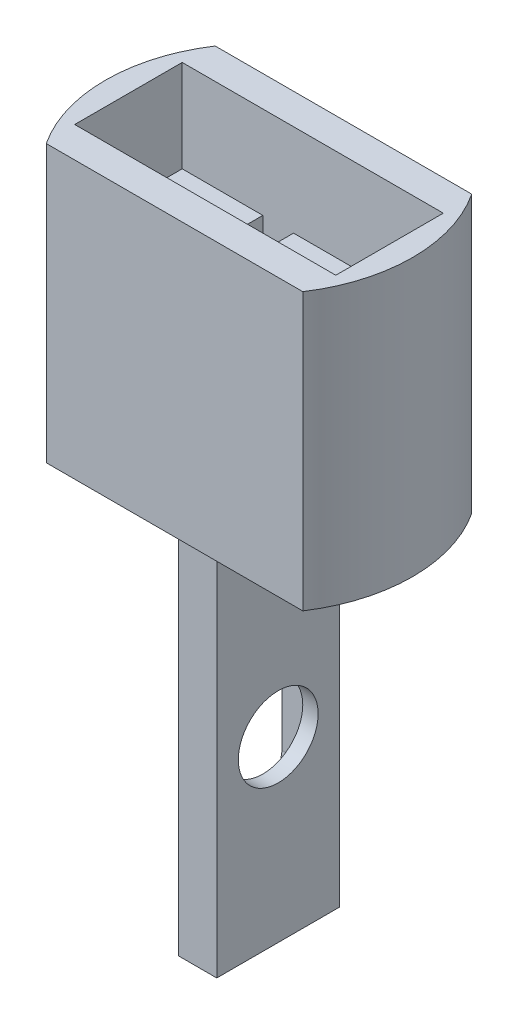
from build123d import *

# Parameters (mm, degrees)
SKETCH3_R           = 10
BOSS_EXTRUDE1_DEPTH = 18
SKETCH4_W           = 2.5
SKETCH4_H           = 8
BOSS_EXTRUDE2_DEPTH = 25
CUT_EXTRUDE1_REACH  = 31.182
SKETCH5_R           = 2.6
SKETCH7_W           = 17
SKETCH7_H           = 7
CUT_EXTRUDE3_DEPTH  = 6
SKETCH8_W           = 2
SKETCH8_H           = 7
CUT_EXTRUDE4_DEPTH  = 4
SKETCH11_W          = 5.5
SKETCH11_H          = 21
CUT_EXTRUDE7_DEPTH  = 1.5
CUT_EXTRUDE5_DEPTH  = 43
BOSS_EXTRUDE3_DEPTH = 1.5


with BuildPart() as part:
    # Sketch3 → Boss-Extrude1 (new body)
    with BuildSketch(Plane(origin=(0, 0, 0), x_dir=(1, 0, 0), z_dir=(0, 1, 0))):
        with Locations(Location((0, 0, 0), (0, 0, 270))):
            Circle(SKETCH3_R)
    extrude(amount=BOSS_EXTRUDE1_DEPTH)

    # Sketch4 → Boss-Extrude2 (add)
    with BuildSketch(Plane(origin=(0, 0, 0), x_dir=(-1, 0, 0), z_dir=(0, -1, 0))):
        Rectangle(SKETCH4_W, SKETCH4_H)
    extrude(amount=BOSS_EXTRUDE2_DEPTH)

    # Sketch5 → Cut-Extrude1 (cut, up to next)
    with BuildSketch(Plane(origin=(1.25, 0, 0), x_dir=(0, 0, -1), z_dir=(1, 0, 0)), mode=Mode.PRIVATE) as cut_extrude1_sk1:
        with Locations((0, -13.4)):
            Circle(SKETCH5_R)
    cut_extrude1_tool1 = extrude(cut_extrude1_sk1.sketch, amount=-CUT_EXTRUDE1_REACH, mode=Mode.PRIVATE) & part.part
    add(cut_extrude1_tool1.solids().sort_by_distance((1.25, -13.4, 0))[0], mode=Mode.SUBTRACT)

    # Sketch7 → Cut-Extrude3 (cut)
    with BuildSketch(Plane(origin=(0, 18, 0), x_dir=(1, 0, 0), z_dir=(0, 1, 0))):
        Rectangle(SKETCH7_W, SKETCH7_H)
    extrude(amount=-CUT_EXTRUDE3_DEPTH, mode=Mode.SUBTRACT)

    # Sketch8 → Cut-Extrude4 (cut)
    with BuildSketch(Plane(origin=(0, 12, 0), x_dir=(1, 0, 0), z_dir=(0, 1, 0))):
        with Locations((-2.25, 0)):
            Rectangle(SKETCH8_W, SKETCH8_H)
    extrude(amount=-CUT_EXTRUDE4_DEPTH, mode=Mode.SUBTRACT)

    # Sketch11 → Cut-Extrude7 (cut)
    with BuildSketch(Plane.ZY.offset(1.25)):
        with Locations((0, -13.4)):
            Rectangle(SKETCH11_W, SKETCH11_H)
    extrude(amount=-CUT_EXTRUDE7_DEPTH, mode=Mode.SUBTRACT)

    # Sketch9 → Cut-Extrude5 (cut)
    with BuildSketch(Plane.XZ):
        with BuildLine():
            Line((8.351646544, -5.5), (-8.351646544, -5.5))
            ThreePointArc((-8.351646544, -5.5), (0, -10), (8.351646544, -5.5))
        make_face()
        with BuildLine():
            Line((8.351646544, 5.5), (-8.351646544, 5.5))
            ThreePointArc((-8.351646544, 5.5), (0, 10), (8.351646544, 5.5))
        make_face()
    extrude(amount=-CUT_EXTRUDE5_DEPTH, mode=Mode.SUBTRACT)

    # Sketch10 → Boss-Extrude3 (add)
    with BuildSketch(Plane.ZY.offset(1.25)):
        Polygon((-2.749970665, -23.9), (-2.749970665, -16.8), (-1.499970665, -23.9), align=None)
        Polygon((1.499970665, -23.9), (2.749970665, -23.9), (2.749970665, -16.8), align=None)
        Polygon((2.749970665, -2.9), (2.749970665, -10), (1.499970665, -2.9), align=None)
        Polygon((-1.499970665, -2.9), (-2.749970665, -2.9), (-2.749970665, -10), align=None)
    extrude(amount=-BOSS_EXTRUDE3_DEPTH)


solid = part.part
